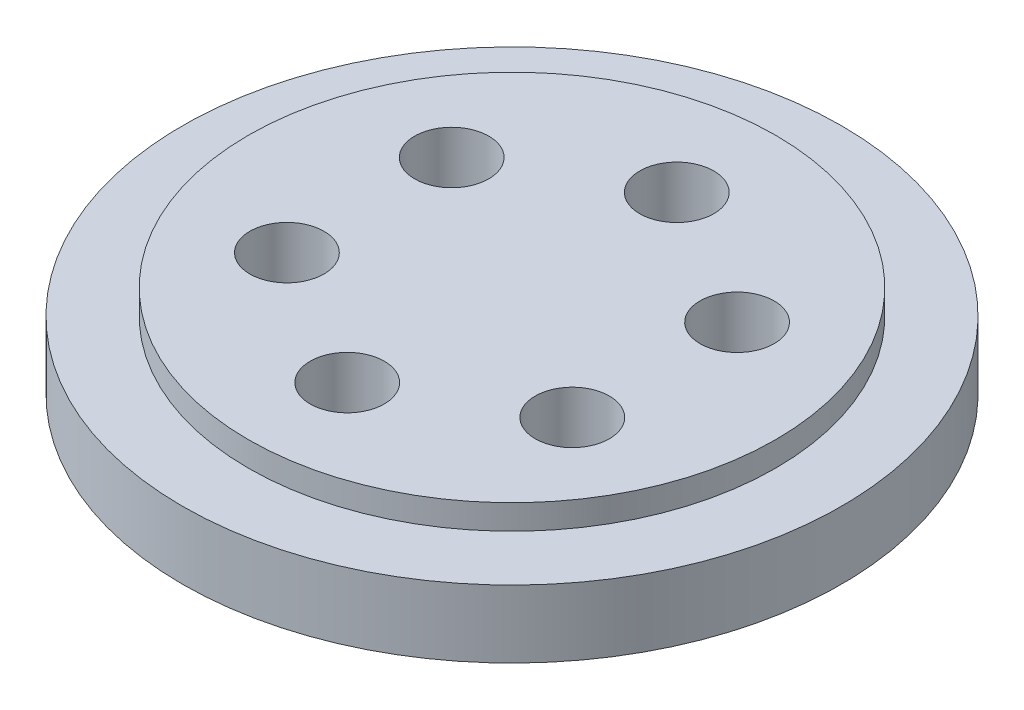
from build123d import *

# Parameters (mm, degrees)
SKIZZE1_R                       = 20
AUFSATZ_LINEAR_AUSTRAGEN1_DEPTH = 5.6
SCHNITT_LINEAR_START            = -1.5
SKIZZE2_R                       = 20
SKIZZE2_R_2                     = 16
SCHNITT_LINEAR_AUSTRAGEN1_DEPTH = 1.5
DURCHGANGSLOCH_F_R_M41_D        = 4.5


with BuildPart() as part:
    # Skizze1 → Aufsatz-Linear austragen1 (new body)
    with BuildSketch(Plane(origin=(0, 0, 0), x_dir=(1, 0, 0), z_dir=(0, 1, 0))):
        with Locations(Location((0, 0, 0), (0, 0, 270))):
            Circle(SKIZZE1_R)
    extrude(amount=AUFSATZ_LINEAR_AUSTRAGEN1_DEPTH)

    # Skizze2 → Schnitt-Linear austragen1 (cut)
    with BuildSketch(Plane(origin=(0, 5.6, 0), x_dir=(1, 0, 0), z_dir=(0, 1, 0)).offset(SCHNITT_LINEAR_START)):
        with Locations(Location((0, 0, 0), (0, 0, 270))):
            Circle(SKIZZE2_R)
        with Locations(Location((0, 0, 0), (0, 0, 270))):
            Circle(SKIZZE2_R_2, mode=Mode.SUBTRACT)
    extrude(amount=SCHNITT_LINEAR_AUSTRAGEN1_DEPTH, mode=Mode.SUBTRACT)

    # Durchgangsloch für M41 (through all)
    with Locations(Plane(origin=(0, 5.6, 0), x_dir=(1, 0, 0), z_dir=(0, 1, 0))):
        with Locations((0, 10), (8.660254038, 5), (8.660254038, -5), (0, -10), (-8.660254038, -5), (-8.660254038, 5)):
            Hole(DURCHGANGSLOCH_F_R_M41_D / 2)


solid = part.part
